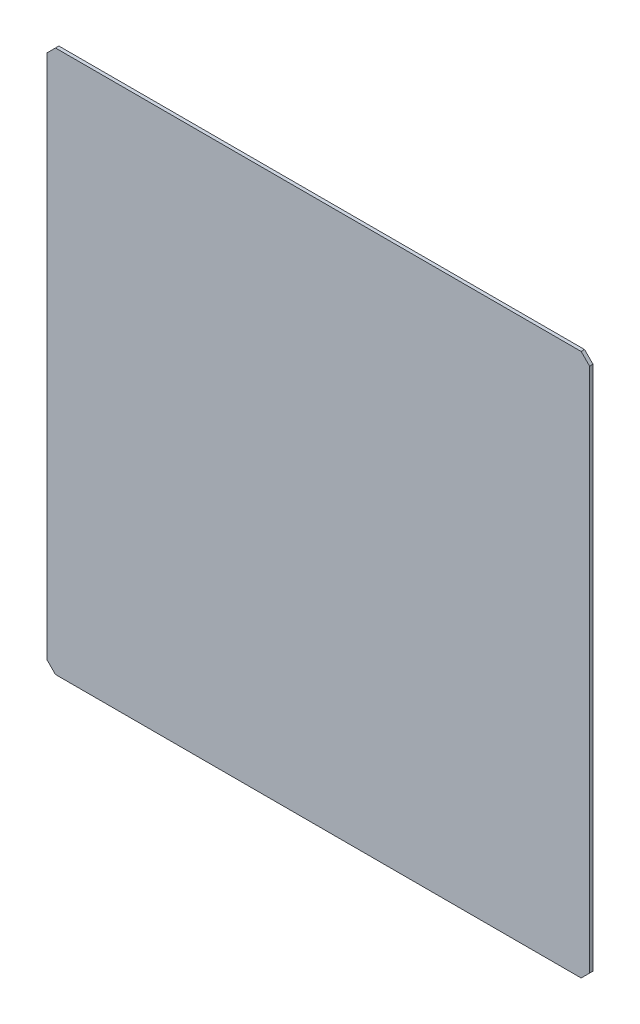
from build123d import *

# Parameters (mm, degrees)
SKETCH2_W           = 320
SKETCH2_H           = 320
BOSS_EXTRUDE1_DEPTH = 2
CHAMFER1_SIZE       = 5


with BuildPart() as part:
    # Sketch2 → Boss-Extrude1 (new body)
    with BuildSketch(Plane.XY):
        Rectangle(SKETCH2_W, SKETCH2_H)
    extrude(amount=BOSS_EXTRUDE1_DEPTH)

    # Chamfer1
    chamfer1_edges = [part.edges().sort_by_distance(p)[0] for p in [
        (160, -160, 1),
        (-160, -160, 1),
        (-160, 160, 1),
        (160, 160, 1),
    ]]
    chamfer(chamfer1_edges, length=CHAMFER1_SIZE)


solid = part.part
